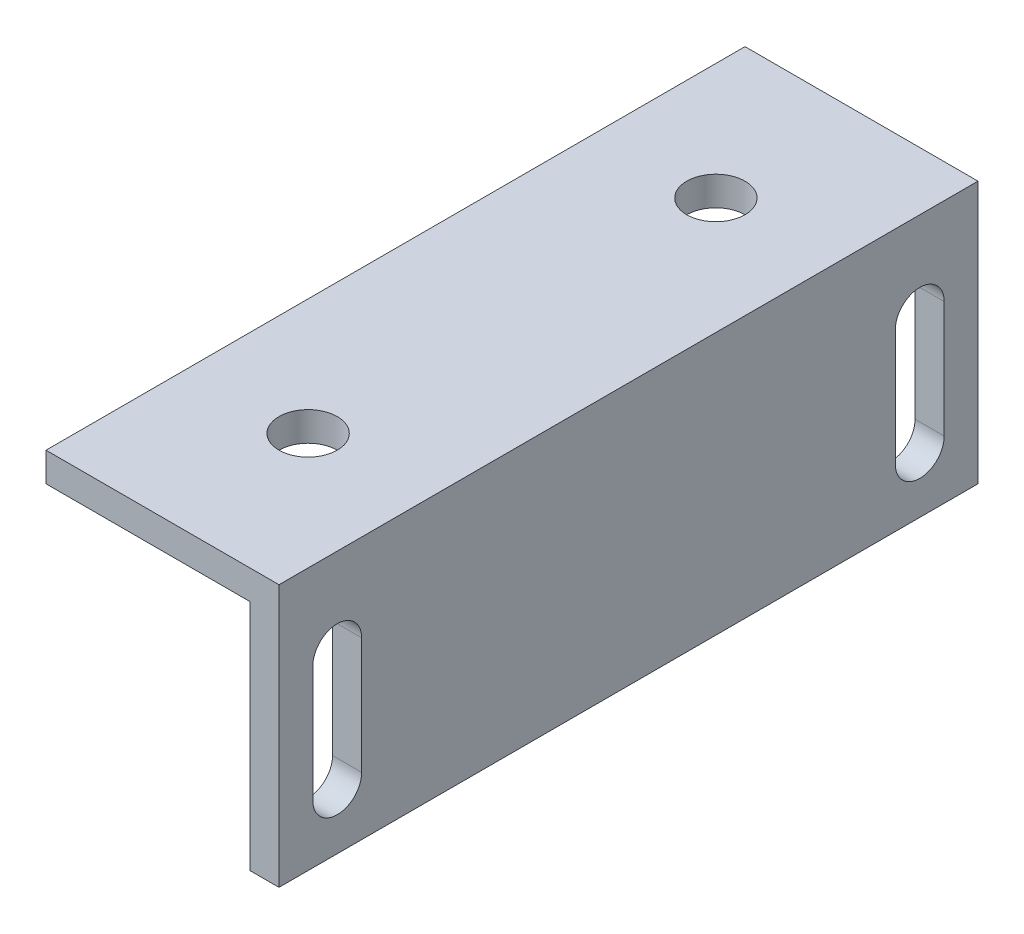
from build123d import *

# Parameters (mm, degrees)
BOSS_EXTRUDE1_DEPTH = 76.2
CUT_EXTRUDE1_REACH  = 97.038
SKETCH2_R           = 3.175
CUT_EXTRUDE2_REACH  = 97.038
SKETCH3_W           = 3.175
SKETCH3_H           = 22.225
CUT_EXTRUDE3_REACH  = 86.362


with BuildPart() as part:
    # Sketch1 → Boss-Extrude1 (new body)
    with BuildSketch(Plane.XY):
        Polygon((0, -50.8), (0, 0), (-25.4, 0), (-25.4, -3.175), (-3.175, -3.175), (-3.175, -50.8), align=None)
    extrude(amount=BOSS_EXTRUDE1_DEPTH)

    # Sketch2 → Cut-Extrude1 (cut, up to next)
    with BuildSketch(Plane(origin=(0, 0, 0), x_dir=(1, 0, 0), z_dir=(0, 1, 0)), mode=Mode.PRIVATE) as cut_extrude1_sk1:
        with Locations(Location((-12.7, -15.875, 0), (0, 0, 270))):
            Circle(SKETCH2_R)
    cut_extrude1_tool1 = extrude(cut_extrude1_sk1.sketch, amount=-CUT_EXTRUDE1_REACH, mode=Mode.PRIVATE) & part.part
    # Sketch2 → Cut-Extrude1 (cut, up to next)
    with BuildSketch(Plane(origin=(0, 0, 0), x_dir=(1, 0, 0), z_dir=(0, 1, 0)), mode=Mode.PRIVATE) as cut_extrude1_sk2:
        with Locations(Location((-12.7, -60.325, 0), (0, 0, 270))):
            Circle(SKETCH2_R)
    cut_extrude1_tool2 = extrude(cut_extrude1_sk2.sketch, amount=-CUT_EXTRUDE1_REACH, mode=Mode.PRIVATE) & part.part
    add(cut_extrude1_tool1.solids().sort_by_distance((-12.7, 0, 15.875))[0], mode=Mode.SUBTRACT)
    add(cut_extrude1_tool2.solids().sort_by_distance((-12.7, 0, 60.325))[0], mode=Mode.SUBTRACT)

    # Sketch3 → Cut-Extrude2 (cut, up to next)
    with BuildSketch(Plane.XY.offset(76.2), mode=Mode.PRIVATE) as cut_extrude2_sk1:
        with Locations((-1.5875, -39.6875)):
            Rectangle(SKETCH3_W, SKETCH3_H)
    cut_extrude2_tool1 = extrude(cut_extrude2_sk1.sketch, amount=-CUT_EXTRUDE2_REACH, mode=Mode.PRIVATE) & part.part
    add(cut_extrude2_tool1.solids().sort_by_distance((-1.5875, -39.6875, 76.2))[0], mode=Mode.SUBTRACT)

    # Sketch4 → Cut-Extrude3 (cut, up to next)
    with BuildSketch(Plane.ZY.offset(3.175), mode=Mode.PRIVATE) as cut_extrude3_sk1:
        with BuildLine():
            Line((72.515, -9.525), (72.515, -22.225))
            ThreePointArc((72.515, -22.225), (69.85, -24.89), (67.185, -22.225))
            Line((67.185, -22.225), (67.185, -9.525))
            ThreePointArc((67.185, -9.525), (69.85, -6.86), (72.515, -9.525))
        make_face()
    cut_extrude3_tool1 = extrude(cut_extrude3_sk1.sketch, amount=-CUT_EXTRUDE3_REACH, mode=Mode.PRIVATE) & part.part
    # Sketch4 → Cut-Extrude3 (cut, up to next)
    with BuildSketch(Plane.ZY.offset(3.175), mode=Mode.PRIVATE) as cut_extrude3_sk2:
        with BuildLine():
            Line((3.685, -9.525), (3.685, -22.225))
            ThreePointArc((3.685, -22.225), (6.35, -24.89), (9.015, -22.225))
            Line((9.015, -22.225), (9.015, -9.525))
            ThreePointArc((9.015, -9.525), (6.35, -6.86), (3.685, -9.525))
        make_face()
    cut_extrude3_tool2 = extrude(cut_extrude3_sk2.sketch, amount=-CUT_EXTRUDE3_REACH, mode=Mode.PRIVATE) & part.part
    add(cut_extrude3_tool1.solids().sort_by_distance((-3.175, -15.875, 69.85))[0], mode=Mode.SUBTRACT)
    add(cut_extrude3_tool2.solids().sort_by_distance((-3.175, -15.875, 6.35))[0], mode=Mode.SUBTRACT)


solid = part.part
